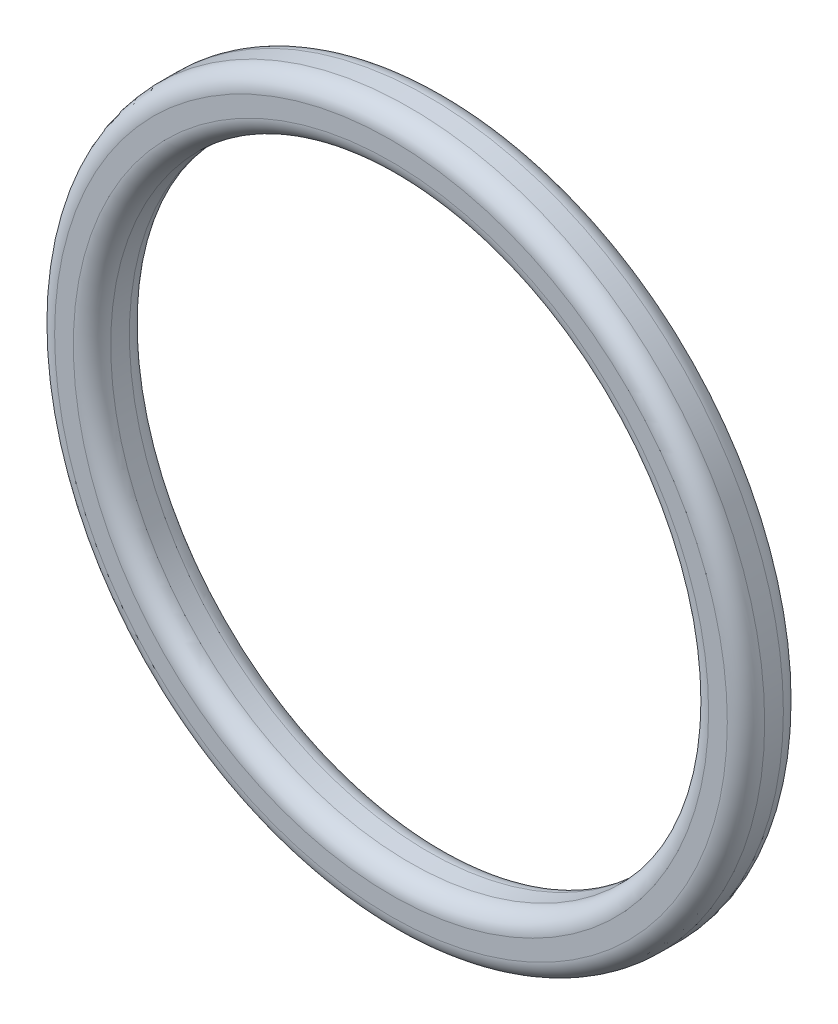
from build123d import *

# Parameters (mm, degrees)
SKETCH1_R           = 9.5
SKETCH1_R_2         = 8
BOSS_EXTRUDE1_DEPTH = 1.5
FILLET1_R           = 0.5


with BuildPart() as part:
    # Sketch1 → Boss-Extrude1 (new body)
    with BuildSketch(Plane.XY):
        Circle(SKETCH1_R)
        Circle(SKETCH1_R_2, mode=Mode.SUBTRACT)
    extrude(amount=BOSS_EXTRUDE1_DEPTH)

    # Fillet1
    fillet1_edges = [part.edges().sort_by_distance(p)[0] for p in [
        (-9.5, 0, 0),
        (-9.5, 0, 1.5),
        (-8, 0, 0),
        (-8, 0, 1.5),
    ]]
    fillet(fillet1_edges, radius=FILLET1_R)


solid = part.part
